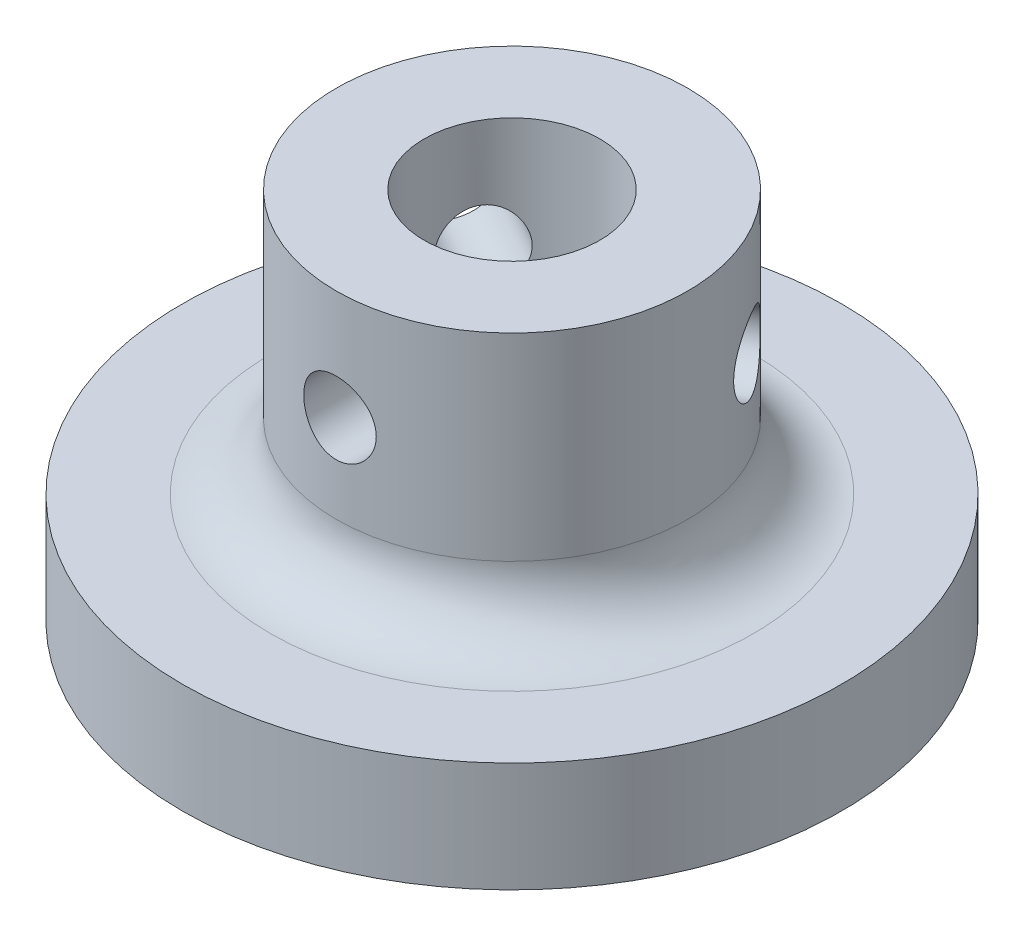
from build123d import *

# Parameters (mm, degrees)
FILLET1_R              = 3
M4_TAPPED_HOLE1_REACH  = 34.296
M4_TAPPED_HOLE1_BORE_R = 1.65
CIRPATTERN1_COUNT      = 3


with BuildPart() as part:
    # Sketch1 → Revolve1 (revolve)
    with BuildSketch(Plane.XY, mode=Mode.PRIVATE) as revolve1_sk:
        Polygon((0, 0), (15, 0), (15, 5), (8, 5), (8, 17), (4, 17), (4, 5), (0, 5), align=None)
    revolve(revolve1_sk.sketch.rotate(Axis((0, 0, 0), (0, 1, 0)), 90), axis=Axis((0, 0, 0), (0, 1, 0)))

    # Fillet1
    fillet1_edges = [part.edges().sort_by_distance(p)[0] for p in [
        (0, 5, 8),
    ]]
    fillet(fillet1_edges, radius=FILLET1_R)

    # M4 Tapped Hole1 bore → M4 Tapped Hole1 (cut, up to next)
    with BuildSketch(Plane.XY.offset(8), mode=Mode.PRIVATE) as m4_tapped_hole1_sk1:
        with Locations((0, 12)):
            Circle(M4_TAPPED_HOLE1_BORE_R)
    m4_tapped_hole1_tool1 = extrude(m4_tapped_hole1_sk1.sketch, amount=-M4_TAPPED_HOLE1_REACH, mode=Mode.PRIVATE) & part.part
    m4_tapped_hole1 = m4_tapped_hole1_tool1.solids().sort_by_distance((0, 12, 8))[0]
    add(m4_tapped_hole1, mode=Mode.SUBTRACT)

    # CirPattern1: M4 Tapped Hole1 ×3 about axis
    cirpattern1_axis = Axis((0, 17, 0), (0, -1, 0))
    for i in range(1, CIRPATTERN1_COUNT):
        add(m4_tapped_hole1.rotate(cirpattern1_axis, i * 360 / CIRPATTERN1_COUNT), mode=Mode.SUBTRACT)


solid = part.part
